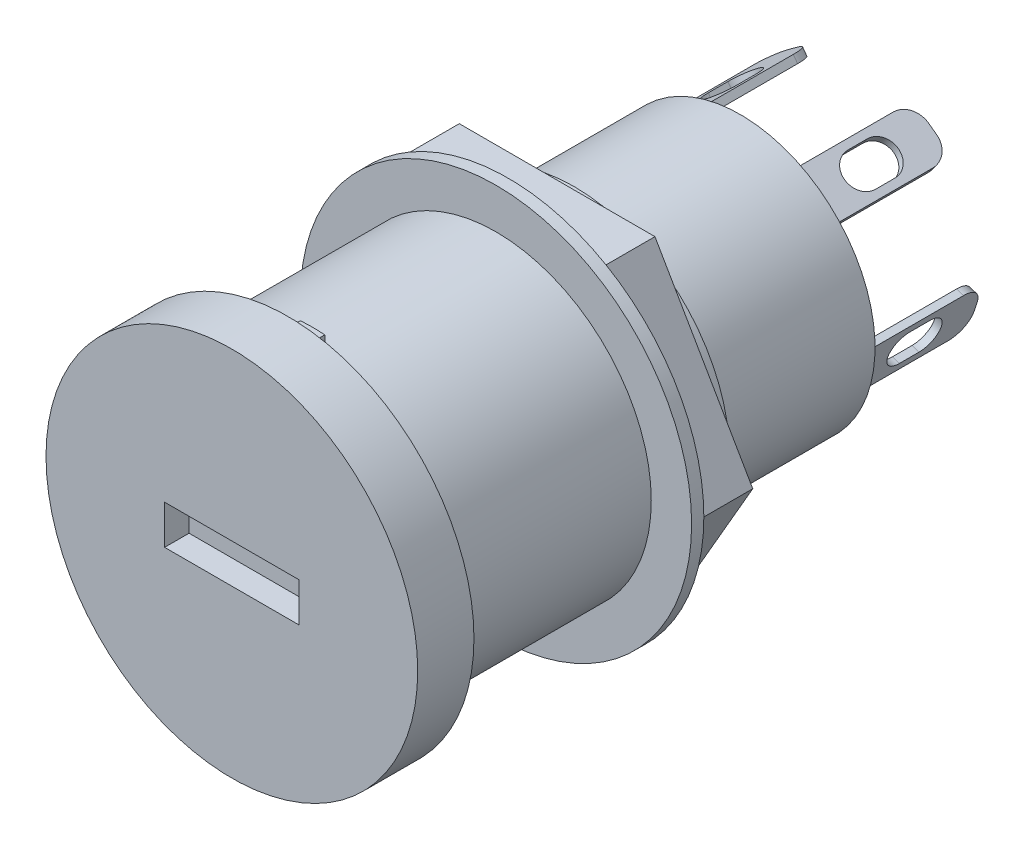
from build123d import *

# Parameters (mm, degrees)
BOSS_EXTRUDE1_DEPTH        = 2
SKETCH3_R                  = 6.35
BOSS_EXTRUDE2_DEPTH        = 0.7
SKETCH4_R                  = 6.35
BOSS_EXTRUDE3_DEPTH        = 0.490747729
BOSS_EXTRUDE3_TAPER        = 60.000000001
SKETCH5_R                  = 5.5
BOSS_EXTRUDE4_DEPTH        = 6.309252271
BOSS_EXTRUDE5_DEPTH        = 5
CUT_EXTRUDE1_DEPTH         = 29.154677259
BOSS_EXTRUDE6_DEPTH        = 5
CUT_EXTRUDE2_DEPTH         = 29.330896625
BOSS_EXTRUDE7_DEPTH        = 5
CUT_EXTRUDE3_DEPTH         = 29.311732629
BOSS_EXTRUDE8_DEPTH        = 5
CUT_EXTRUDE4_DEPTH         = 29.498497405
BOSS_EXTRUDE9_REACH        = 28.981
BOSS_EXTRUDE9_START_RADIUS = 6.35
BOSS_EXTRUDE9_END_RADIUS   = 6.35
SKETCH14_W                 = 1
SKETCH14_H                 = 1
FILLET1_R                  = 0.8
SKETCH15_W                 = 5.5
SKETCH15_H                 = 1.6
CUT_EXTRUDE5_DEPTH         = 1


with BuildPart() as part:
    # Sketch1 → Revolve1 (revolve)
    with BuildSketch(Plane.XZ, mode=Mode.PRIVATE) as revolve1_sk:
        Polygon((7.6, 2.3), (0, 2.3), (0, -9), (8, -9), (8, -8.5), (6.35, -8.5), (6.35, 0), (7.6, 0), align=None)
    revolve(revolve1_sk.sketch.rotate(Axis((0, 0, 2.3), (0, 0, -1)), 180), axis=Axis((0, 0, 2.3), (0, 0, -1)))

    # Sketch2 → Boss-Extrude1 (add)
    with BuildSketch(Plane(origin=(0, 0, -9), x_dir=(-1, 0, 0), z_dir=(0, 0, -1))):
        Polygon((-4, -6.92820323), (-8, 0), (-4, 6.92820323), (4, 6.92820323), (8, 0), (4, -6.92820323), align=None)
    extrude(amount=BOSS_EXTRUDE1_DEPTH)

    # Sketch3 → Boss-Extrude2 (add)
    with BuildSketch(Plane(origin=(0, 0, -11), x_dir=(-1, 0, 0), z_dir=(0, 0, -1))):
        Circle(SKETCH3_R)
    extrude(amount=BOSS_EXTRUDE2_DEPTH)

    # Sketch4 → Boss-Extrude3 (add)
    with BuildSketch(Plane(origin=(0, 0, -11.7), x_dir=(-1, 0, 0), z_dir=(0, 0, -1))):
        Circle(SKETCH4_R)
    extrude(amount=BOSS_EXTRUDE3_DEPTH, taper=BOSS_EXTRUDE3_TAPER)

    # Sketch5 → Boss-Extrude4 (add)
    with BuildSketch(Plane(origin=(0, 0, -12.190747729), x_dir=(-1, 0, 0), z_dir=(0, 0, -1))):
        Circle(SKETCH5_R)
    extrude(amount=BOSS_EXTRUDE4_DEPTH)

    # Sketch6 → Boss-Extrude5 (add)
    with BuildSketch(Plane(origin=(0, 0, -18.5), x_dir=(-1, 0, 0), z_dir=(0, 0, -1))):
        Polygon((-4.921641098, -0.547675906), (-4.636324144, -0.454970808), (-4.018290155, -2.357083841), (-4.30360711, -2.449788939), align=None)
    extrude(amount=BOSS_EXTRUDE5_DEPTH)

    # Sketch7 → Cut-Extrude1 (cut, through all)
    with BuildSketch(Plane(origin=(4.327307149, -1.406027324, 0), x_dir=(0, 0, 1), z_dir=(-0.9510565162951721, 0.30901699437489094, 0))):
        with BuildLine():
            Line((-21.4, -0.7), (-20.6, -0.7))
            ThreePointArc((-20.6, -0.7), (-19.9, 0), (-20.6, 0.7))
            Line((-20.6, 0.7), (-21.4, 0.7))
            ThreePointArc((-21.4, 0.7), (-22.1, 0), (-21.4, -0.7))
        make_face()
    extrude(amount=-CUT_EXTRUDE1_DEPTH, mode=Mode.SUBTRACT)

    # Sketch8 → Boss-Extrude6 (add)
    with BuildSketch(Plane(origin=(0, 0, -18.5), x_dir=(-1, 0, 0), z_dir=(0, 0, -1))):
        Polygon((-3.483439892, 3.093242072), (-3.659775468, 3.33594717), (-2.041741479, 4.511517675), (-1.865405904, 4.268812577), align=None)
    extrude(amount=BOSS_EXTRUDE6_DEPTH)

    # Sketch9 → Cut-Extrude2 (cut, through all)
    with BuildSketch(Plane(origin=(2.674422898, 3.681027324, 0), x_dir=(0.8090169943747798, -0.5877852522927041, 0), z_dir=(-0.587785252292704, -0.8090169943747797, 0))):
        with BuildLine():
            Line((0.7, -21.4), (0.7, -20.6))
            ThreePointArc((0.7, -20.6), (0, -19.9), (-0.7, -20.6))
            Line((-0.7, -20.6), (-0.7, -21.4))
            ThreePointArc((-0.7, -21.4), (0, -22.1), (0.7, -21.4))
        make_face()
    extrude(amount=-CUT_EXTRUDE2_DEPTH, mode=Mode.SUBTRACT)

    # Sketch10 → Boss-Extrude7 (add)
    with BuildSketch(Plane(origin=(0, 0, -18.5), x_dir=(-1, 0, 0), z_dir=(0, 0, -1))):
        Polygon((4.636324144, -0.454970808), (4.921641098, -0.547675906), (4.30360711, -2.449788939), (4.018290155, -2.357083841), align=None)
    extrude(amount=BOSS_EXTRUDE7_DEPTH)

    # Sketch11 → Cut-Extrude3 (cut, through all)
    with BuildSketch(Plane(origin=(-4.612624104, -1.498732423, 0), x_dir=(0, 0, 1), z_dir=(-0.9510565162951283, -0.3090169943750252, 0))):
        with BuildLine():
            Line((-20.6, 0.7), (-21.4, 0.7))
            ThreePointArc((-21.4, 0.7), (-22.1, 0), (-21.4, -0.7))
            Line((-21.4, -0.7), (-20.6, -0.7))
            ThreePointArc((-20.6, -0.7), (-19.9, 0), (-20.6, 0.7))
        make_face()
    extrude(amount=-CUT_EXTRUDE3_DEPTH, mode=Mode.SUBTRACT)

    # Sketch12 → Boss-Extrude8 (add)
    with BuildSketch(Plane(origin=(0, 0, -18.5), x_dir=(-1, 0, 0), z_dir=(0, 0, -1))):
        Polygon((1.865405904, 4.268812577), (2.041741479, 4.511517675), (3.659775468, 3.33594717), (3.483439892, 3.093242072), align=None)
    extrude(amount=BOSS_EXTRUDE8_DEPTH)

    # Sketch13 → Cut-Extrude4 (cut, through all)
    with BuildSketch(Plane(origin=(-2.850758474, 3.923732423, 0), x_dir=(-0.8090169943749189, -0.5877852522925126, 0), z_dir=(-0.5877852522925126, 0.8090169943749189, 0))):
        with BuildLine():
            Line((-0.7, -20.6), (-0.7, -21.4))
            ThreePointArc((-0.7, -21.4), (0, -22.1), (0.7, -21.4))
            Line((0.7, -21.4), (0.7, -20.6))
            ThreePointArc((0.7, -20.6), (0, -19.9), (-0.7, -20.6))
        make_face()
    extrude(amount=-CUT_EXTRUDE4_DEPTH, mode=Mode.SUBTRACT)

    # Boss-Extrude9: from a cylinder face, 28.981 long prism both ways, kept between that surface and its translate by the depth
    boss_extrude9_start = Plane(origin=(0, 0, -0.5), z_dir=(0, 0, -1)) * Cylinder(BOSS_EXTRUDE9_START_RADIUS, 71.662, mode=Mode.PRIVATE)
    boss_extrude9_end = Plane(origin=(0, 0.369715646, -0.5), z_dir=(0, 0, -1)) * Cylinder(BOSS_EXTRUDE9_END_RADIUS, 71.662, mode=Mode.PRIVATE)
    # Sketch14 → Boss-Extrude9 (add, from a surface)
    with BuildSketch(Plane(origin=(0, -1.5875, 0), x_dir=(1, 0, 0), z_dir=(0, 1, 0)), mode=Mode.PRIVATE) as boss_extrude9_sk1:
        with Locations((0, 0.5)):
            Rectangle(SKETCH14_W, SKETCH14_H)
    boss_extrude9_tool1 = extrude(boss_extrude9_sk1.sketch, amount=BOSS_EXTRUDE9_REACH, both=True, mode=Mode.PRIVATE)
    add(((boss_extrude9_tool1 - boss_extrude9_start) & boss_extrude9_end).solids().sort_by_distance((0, 6.515142, -0.5))[0])

    # Fillet1
    fillet1_edges = [part.edges().sort_by_distance(p)[0] for p in [
        (-4.160948632, -2.40343639, -23.5),
        (-4.778982621, -0.501323357, -23.5),
        (-3.57160768, 3.214594621, -23.5),
        (-1.953573691, 4.390165126, -23.5),
        (4.160948632, -2.40343639, -23.5),
        (4.778982621, -0.501323357, -23.5),
        (1.953573691, 4.390165126, -23.5),
        (3.57160768, 3.214594621, -23.5),
    ]]
    fillet(fillet1_edges, radius=FILLET1_R)

    # Sketch15 → Cut-Extrude5 (cut)
    with BuildSketch(Plane.XY.offset(2.3)):
        Rectangle(SKETCH15_W, SKETCH15_H)
    extrude(amount=-CUT_EXTRUDE5_DEPTH, mode=Mode.SUBTRACT)


solid = part.part
